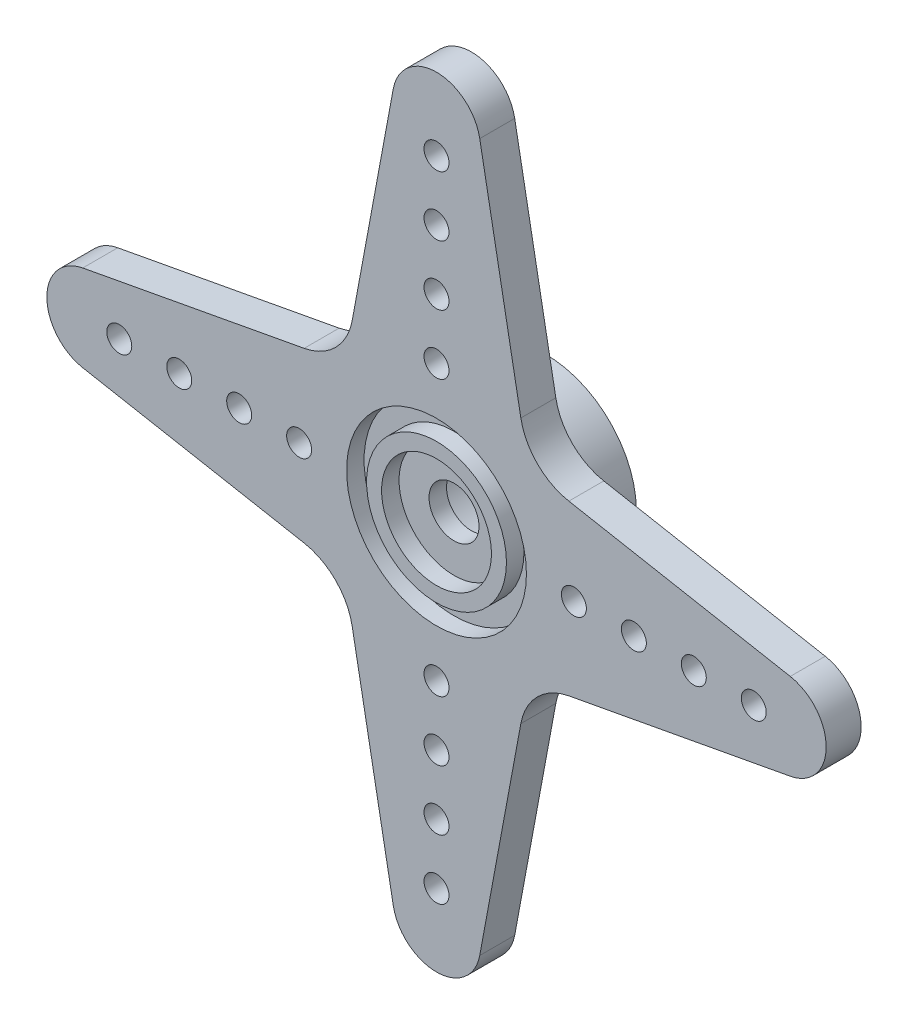
from build123d import *

# Parameters (mm, degrees)
SKETCH1_R               = 4.5000037
BOSS_EXTRUDE1_DEPTH     = 3.75000012
BOSS_EXTRUDE2_START     = 1.750000056
SKETCH2_R               = 4.5000037
SKETCH2_R_2             = 3.499999998
SKETCH2_R_3             = 1.25000004
BOSS_EXTRUDE2_DEPTH     = 1.750000056
SKETCH4_R               = 2.75000466
SKETCH4_R_2             = 1.25000004
CUT_EXTRUDE1_DEPTH      = 0.875000028
SKETCH6_R               = 4.5000037
SKETCH6_R_2             = 3.5000057
CUT_EXTRUDE2_DEPTH      = 0.875000028
SKETCH10_R              = 0.62500002
SKETCH10_R_2            = 4.5000037
BOSS_EXTRUDE4_DEPTH     = 1.750000056
CHAMFER2_SIZE           = 1.00000054
CHAMFER2_SIZE2          = 0.577350581
ESQUISSE1_R             = 2.999994
ENL_V_MAT_EXTRU_1_DEPTH = 3.75000012


with BuildPart() as part:
    # Sketch1 → Boss-Extrude1 (new body)
    with BuildSketch(Plane.XY):
        with Locations((-10.24995918, 0)):
            Circle(SKETCH1_R)
        Polygon((-10.24995918, 2.999994), (-10.594624819, 2.728309468), (-10.996027349, 2.905743672), (-11.262299488, 2.55687975), (-11.695217312, 2.628914782), (-11.866365092, 2.224791874), (-12.303596391, 2.186901508), (-12.368865968, 1.752912142), (-12.782937891, 1.60747717), (-12.738228138, 1.170890494), (-13.103123023, 0.927049129), (-12.951243218, 0.515297489), (-13.244033377, 0.188371182), (-12.994526687, -0.172673551), (-13.196815038, -0.562142819), (-12.865358886, -0.849794878), (-12.964434908, -1.27733532), (-12.571855902, -1.473520467), (-12.561494285, -1.912268145), (-12.132459609, -2.004659346), (-12.01331141, -2.427046129), (-11.574778889, -2.409838105), (-11.354330629, -2.789323879), (-10.933854876, -2.663597874), (-10.625958129, -2.976338151), (-10.24995918, -2.749993992), (-9.873960231, -2.976338151), (-9.566063484, -2.663597874), (-9.145587731, -2.789323879), (-8.925139471, -2.409838105), (-8.48660695, -2.427046129), (-8.367458751, -2.004659346), (-7.938424075, -1.912268145), (-7.928062458, -1.473520467), (-7.535483452, -1.27733532), (-7.634559474, -0.849794878), (-7.303103322, -0.562142819), (-7.505391673, -0.172673551), (-7.255884983, 0.188371182), (-7.548675142, 0.515297489), (-7.396795337, 0.927049129), (-7.761690222, 1.170890494), (-7.716980469, 1.60747717), (-8.131052392, 1.752912142), (-8.196321969, 2.186901508), (-8.633553268, 2.224791874), (-8.804701048, 2.628914782), (-9.237618872, 2.55687975), (-9.503891011, 2.905743672), (-9.905293541, 2.728309468), align=None, mode=Mode.SUBTRACT)
    extrude(amount=-BOSS_EXTRUDE1_DEPTH)

    # Sketch2 → Boss-Extrude2 (add)
    # profile 1 of 2: a face of its own
    with BuildSketch(Plane.XY.offset(BOSS_EXTRUDE2_START)):
        with Locations((-10.24995918, 0)):
            Circle(SKETCH2_R)
        with Locations((-10.24995918, 0)):
            Circle(SKETCH2_R_2, mode=Mode.SUBTRACT)
    # profile 2 of 2: a face of its own
    with BuildSketch(Plane.XY.offset(BOSS_EXTRUDE2_START)):
        with Locations((-10.24995918, 0)):
            Circle(SKETCH2_R_2)
        with Locations((-10.24995918, 0)):
            Circle(SKETCH2_R_3, mode=Mode.SUBTRACT)
    extrude(amount=-BOSS_EXTRUDE2_DEPTH)

    # Sketch4 → Cut-Extrude1 (cut)
    with BuildSketch(Plane.XY.offset(1.750000056)):
        with Locations((-10.24995918, 0)):
            Circle(SKETCH4_R)
        with Locations((-10.24995918, 0)):
            Circle(SKETCH4_R_2, mode=Mode.SUBTRACT)
    extrude(amount=-CUT_EXTRUDE1_DEPTH, mode=Mode.SUBTRACT)

    # Sketch6 → Cut-Extrude2 (cut)
    with BuildSketch(Plane.XY.offset(1.750000056)):
        with Locations((-10.24995918, 0)):
            Circle(SKETCH6_R)
        with Locations((-10.24995918, 0)):
            Circle(SKETCH6_R_2, mode=Mode.SUBTRACT)
    extrude(amount=-CUT_EXTRUDE2_DEPTH, mode=Mode.SUBTRACT)

    # Sketch10 → Boss-Extrude4 (add)
    with BuildSketch(Plane.XY.offset(1.750000056)):
        with BuildLine():
            Line((-8.086927824, 17.701557226), (-6.029886341, 6.622035833))
            ThreePointArc((-6.029886341, 6.622035833), (-5.20161423, 5.04834495), (-3.627923347, 4.220072839))
            Line((-3.627923347, 4.220072839), (7.451598046, 2.163031356))
            ThreePointArc((7.451598046, 2.163031356), (9.25000182, 0), (7.451598046, -2.163031356))
            Line((7.451598046, -2.163031356), (-3.627923347, -4.220072839))
            ThreePointArc((-3.627923347, -4.220072839), (-5.20161423, -5.04834495), (-6.029886341, -6.622035833))
            Line((-6.029886341, -6.622035833), (-8.086927824, -17.701557226))
            ThreePointArc((-8.086927824, -17.701557226), (-10.24995918, -19.499961), (-12.412990536, -17.701557226))
            Line((-12.412990536, -17.701557226), (-14.470032019, -6.622035833))
            ThreePointArc((-14.470032019, -6.622035833), (-15.29830413, -5.04834495), (-16.871995013, -4.220072839))
            Line((-16.871995013, -4.220072839), (-27.951516406, -2.163031356))
            ThreePointArc((-27.951516406, -2.163031356), (-29.74992018, 0), (-27.951516406, 2.163031356))
            Line((-27.951516406, 2.163031356), (-16.871995013, 4.220072839))
            ThreePointArc((-16.871995013, 4.220072839), (-15.29830413, 5.04834495), (-14.470032019, 6.622035833))
            Line((-14.470032019, 6.622035833), (-12.412990536, 17.701557226))
            ThreePointArc((-12.412990536, 17.701557226), (-10.24995918, 19.499961), (-8.086927824, 17.701557226))
        make_face()
        with Locations((-10.24995918, 15.87496698)):
            Circle(SKETCH10_R, mode=Mode.SUBTRACT)
        with Locations((-10.24995918, 12.87497298)):
            Circle(SKETCH10_R, mode=Mode.SUBTRACT)
        with Locations((-10.24995918, 9.87497898)):
            Circle(SKETCH10_R, mode=Mode.SUBTRACT)
        with Locations((-10.24995918, 6.87498498)):
            Circle(SKETCH10_R, mode=Mode.SUBTRACT)
        with Locations((5.6250078, 0)):
            Circle(SKETCH10_R, mode=Mode.SUBTRACT)
        with Locations((2.6250138, 0)):
            Circle(SKETCH10_R, mode=Mode.SUBTRACT)
        with Locations((-0.3749802, 0)):
            Circle(SKETCH10_R, mode=Mode.SUBTRACT)
        with Locations((-3.3749742, 0)):
            Circle(SKETCH10_R, mode=Mode.SUBTRACT)
        with Locations((-10.24995918, -15.87496698)):
            Circle(SKETCH10_R, mode=Mode.SUBTRACT)
        with Locations((-10.24995918, -12.87497298)):
            Circle(SKETCH10_R, mode=Mode.SUBTRACT)
        with Locations((-10.24995918, -9.87497898)):
            Circle(SKETCH10_R, mode=Mode.SUBTRACT)
        with Locations((-10.24995918, -6.87498498)):
            Circle(SKETCH10_R, mode=Mode.SUBTRACT)
        with Locations((-26.12492616, 0)):
            Circle(SKETCH10_R, mode=Mode.SUBTRACT)
        with Locations((-23.12493216, 0)):
            Circle(SKETCH10_R, mode=Mode.SUBTRACT)
        with Locations((-20.12493816, 0)):
            Circle(SKETCH10_R, mode=Mode.SUBTRACT)
        with Locations((-17.12494416, 0)):
            Circle(SKETCH10_R, mode=Mode.SUBTRACT)
        with Locations((-10.24995918, 0)):
            Circle(SKETCH10_R_2, mode=Mode.SUBTRACT)
    extrude(amount=-BOSS_EXTRUDE4_DEPTH)

    # Chamfer2
    chamfer2_edges = [part.edges().sort_by_distance(p)[0] for p in [
        (-14.74996288, 0, 0),
    ]]
    chamfer2_side = [part.faces().sort_by_distance(p)[0] for p in [
        (-14.74996288, 0, -1.87500006),
    ]]
    chamfer(chamfer2_edges, length=CHAMFER2_SIZE, length2=CHAMFER2_SIZE2, reference=chamfer2_side[0])

    # Esquisse1 → Enlèv. mat.-Extru.1 (cut)
    with BuildSketch(Plane(origin=(0, 0, -3.75000012), x_dir=(-1, 0, 0), z_dir=(0, 0, -1))):
        with Locations((10.24995918, 0)):
            Circle(ESQUISSE1_R)
    extrude(amount=-ENL_V_MAT_EXTRU_1_DEPTH, mode=Mode.SUBTRACT)


solid = part.part
